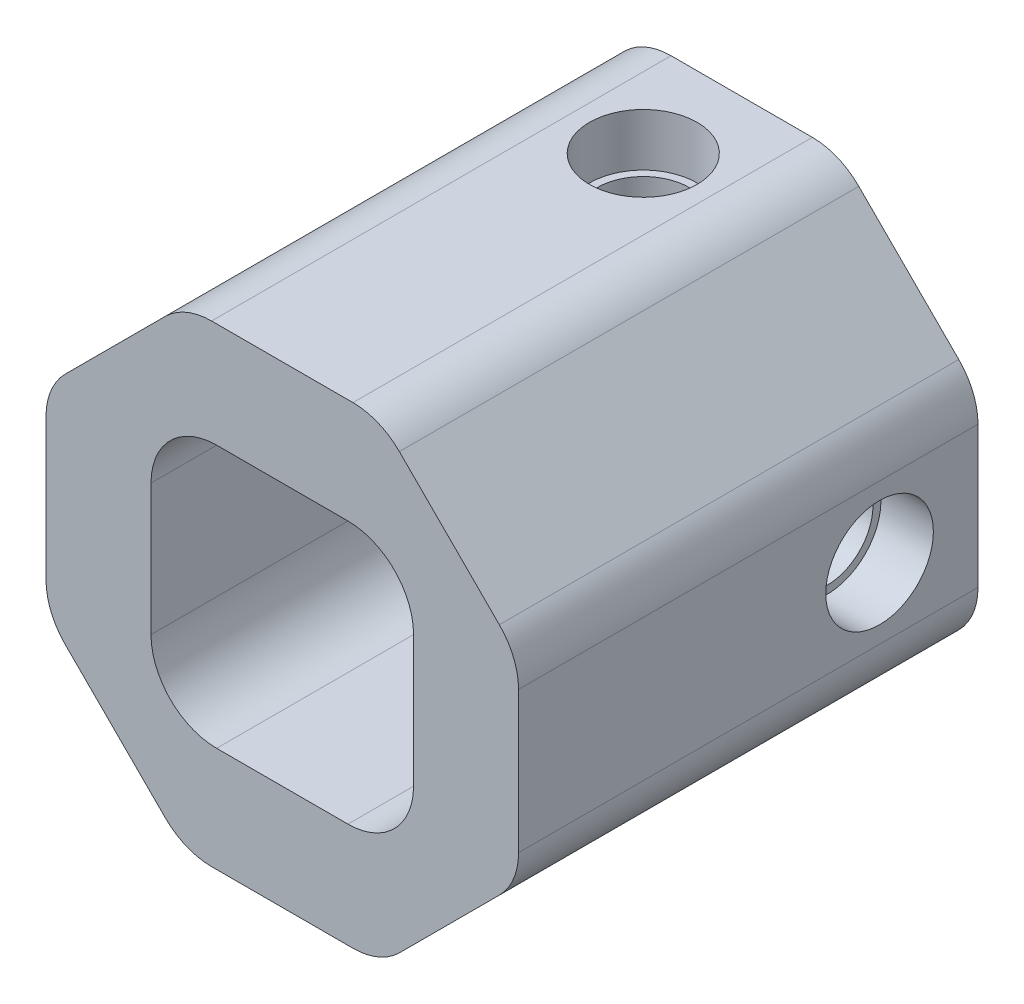
from build123d import *

# Parameters (mm, degrees)
EXTRUDE_1_DEPTH          = 7.5
CUT_EXTRUDE_1_DEPTH      = 30.546573405
CUT_EXTRUDE_1_DEPTH_BACK = 30.546573405
SKETCH_2_W               = 20
SKETCH_2_H               = 20
FILLET_1_R               = 5
FILLET_2_R               = 5
CUT_EXTRUDE_2_DEPTH      = 41.942032192
CUT_EXTRUDE_2_DEPTH_BACK = 41.942032192
SKETCH_3_R               = 4.1
CUT_EXTRUDE_3_DEPTH      = 41.942032192
CUT_EXTRUDE_3_DEPTH_BACK = 41.942032192
SKETCH_4_R               = 4.1
EXTRUDE_START            = 20
EXTRUDE_2_DEPTH          = 20
EXTRUDE_START_2          = -4
SKETCH_6_R               = 4.1
SKETCH_6_R_2             = 3.5
EXTRUDE_3_DEPTH          = 4
SKETCH_7_R               = 4.1
SKETCH_7_R_2             = 3.5
EXTRUDE_4_DEPTH          = 4
EXTRUDE_START_3          = -8
SKETCH_8_R               = 4.1
SKETCH_8_R_2             = 3.5
EXTRUDE_5_DEPTH          = 4
SKETCH_9_R               = 4.1
SKETCH_9_R_2             = 3.5
EXTRUDE_6_DEPTH          = 4


with BuildPart() as part:
    # ｽｹｯﾁ1 → ﾎﾞｽ - 押し出し1 (new, symmetric)
    with BuildSketch(Plane.XY):
        Polygon((7.455844123, -18), (18, -7.455844123), (18, 7.455844123), (7.455844123, 18), (-7.455844123, 18), (-18, 7.455844123), (-18, -7.455844123), (-7.455844123, -18), align=None)
    extrude(amount=EXTRUDE_1_DEPTH, both=True)

    # ｽｹｯﾁ2 → ｶｯﾄ - 押し出し1 (cut, two sides: drawn at the far end of the back side and taken through both)
    with BuildSketch(Plane.XY.offset(7.5).offset(-CUT_EXTRUDE_1_DEPTH_BACK)):
        Rectangle(SKETCH_2_W, SKETCH_2_H)
    extrude(amount=CUT_EXTRUDE_1_DEPTH + CUT_EXTRUDE_1_DEPTH_BACK, mode=Mode.SUBTRACT)

    # ﾌｨﾚｯﾄ1
    fillet_1_edges = [part.edges().sort_by_distance(p)[0] for p in [
        (-10, -10, 0),
        (-10, 10, 0),
        (10, 10, 0),
        (10, -10, 0),
    ]]
    fillet(fillet_1_edges, radius=FILLET_1_R)

    # ﾌｨﾚｯﾄ2
    fillet_2_edges = [part.edges().sort_by_distance(p)[0] for p in [
        (-7.455844123, 18, 0),
        (7.455844123, 18, 0),
        (18, 7.455844123, 0),
        (18, -7.455844123, 0),
        (7.455844123, -18, 0),
        (-7.455844123, -18, 0),
        (-18, -7.455844123, 0),
        (-18, 7.455844123, 0),
    ]]
    fillet(fillet_2_edges, radius=FILLET_2_R)

    # ｽｹｯﾁ3 → ｶｯﾄ - 押し出し2 (cut, two sides: drawn at the far end of the back side and taken through both)
    with BuildSketch(Plane.XZ.offset(18).offset(-CUT_EXTRUDE_2_DEPTH_BACK)):
        with Locations(Location((0, 0, 0), (0, 0, 270))):
            Circle(SKETCH_3_R)
    extrude(amount=CUT_EXTRUDE_2_DEPTH + CUT_EXTRUDE_2_DEPTH_BACK, mode=Mode.SUBTRACT)

    # ｽｹｯﾁ4 → ｶｯﾄ - 押し出し3 (cut, two sides: drawn at the far end of the back side and taken through both)
    with BuildSketch(Plane(origin=(18, 0, 0), x_dir=(0, 0, -1), z_dir=(1, 0, 0)).offset(-CUT_EXTRUDE_3_DEPTH_BACK)):
        Circle(SKETCH_4_R)
    extrude(amount=CUT_EXTRUDE_3_DEPTH + CUT_EXTRUDE_3_DEPTH_BACK, mode=Mode.SUBTRACT)

    # ｽｹｯﾁ5 → ﾎﾞｽ - 押し出し2 (add)
    with BuildSketch(Plane.XY.offset(7.5).offset(EXTRUDE_START)):
        with BuildLine():
            Line((8.920310217, -16.535533906), (16.535533906, -8.920310217))
            ThreePointArc((16.535533906, -8.920310217), (17.619397663, -7.298193473), (18, -5.384776311))
            Line((18, -5.384776311), (18, 5.384776311))
            ThreePointArc((18, 5.384776311), (17.619397663, 7.298193473), (16.535533906, 8.920310217))
            Line((16.535533906, 8.920310217), (8.920310217, 16.535533906))
            ThreePointArc((8.920310217, 16.535533906), (7.298193473, 17.619397663), (5.384776311, 18))
            Line((5.384776311, 18), (-5.384776311, 18))
            ThreePointArc((-5.384776311, 18), (-7.298193473, 17.619397663), (-8.920310217, 16.535533906))
            Line((-8.920310217, 16.535533906), (-16.535533906, 8.920310217))
            ThreePointArc((-16.535533906, 8.920310217), (-17.619397663, 7.298193473), (-18, 5.384776311))
            Line((-18, 5.384776311), (-18, -5.384776311))
            ThreePointArc((-18, -5.384776311), (-17.619397663, -7.298193473), (-16.535533906, -8.920310217))
            Line((-16.535533906, -8.920310217), (-8.920310217, -16.535533906))
            ThreePointArc((-8.920310217, -16.535533906), (-7.298193473, -17.619397663), (-5.384776311, -18))
            Line((-5.384776311, -18), (5.384776311, -18))
            ThreePointArc((5.384776311, -18), (7.298193473, -17.619397663), (8.920310217, -16.535533906))
        make_face()
        with BuildLine():
            Line((5, 10), (-5, 10))
            ThreePointArc((-5, 10), (-8.535533906, 8.535533906), (-10, 5))
            Line((-10, 5), (-10, -5))
            ThreePointArc((-10, -5), (-8.535533906, -8.535533906), (-5, -10))
            Line((-5, -10), (5, -10))
            ThreePointArc((5, -10), (8.535533906, -8.535533906), (10, -5))
            Line((10, -5), (10, 5))
            ThreePointArc((10, 5), (8.535533906, 8.535533906), (5, 10))
        make_face(mode=Mode.SUBTRACT)
    extrude(amount=-EXTRUDE_2_DEPTH)

    # ｽｹｯﾁ6 → ﾎﾞｽ - 押し出し3 (add)
    with BuildSketch(Plane.XZ.offset(18).offset(EXTRUDE_START_2)):
        Circle(SKETCH_6_R)
        Circle(SKETCH_6_R_2, mode=Mode.SUBTRACT)
    extrude(amount=-EXTRUDE_3_DEPTH)

    # ｽｹｯﾁ7 → ﾎﾞｽ - 押し出し4 (add)
    with BuildSketch(Plane(origin=(18, 0, 0), x_dir=(0, 0, -1), z_dir=(1, 0, 0)).offset(EXTRUDE_START_2)):
        with Locations(Location((0, 0, 0), (0, 0, 90))):
            Circle(SKETCH_7_R)
        Circle(SKETCH_7_R_2, mode=Mode.SUBTRACT)
    extrude(amount=-EXTRUDE_4_DEPTH)

    # ｽｹｯﾁ8 → ﾎﾞｽ - 押し出し5 (add)
    with BuildSketch(Plane(origin=(0, 18, 0), x_dir=(1, 0, 0), z_dir=(0, 1, 0)).offset(EXTRUDE_START_3)):
        Circle(SKETCH_8_R)
        Circle(SKETCH_8_R_2, mode=Mode.SUBTRACT)
    extrude(amount=EXTRUDE_5_DEPTH)

    # ｽｹｯﾁ9 → ﾎﾞｽ - 押し出し6 (add)
    with BuildSketch(Plane.ZY.offset(18).offset(EXTRUDE_START_3)):
        with Locations(Location((0, 0, 0), (0, 0, 90))):
            Circle(SKETCH_9_R)
        with Locations(Location((0, 0, 0), (0, 0, 180))):
            Circle(SKETCH_9_R_2, mode=Mode.SUBTRACT)
    extrude(amount=EXTRUDE_6_DEPTH)


solid = part.part
